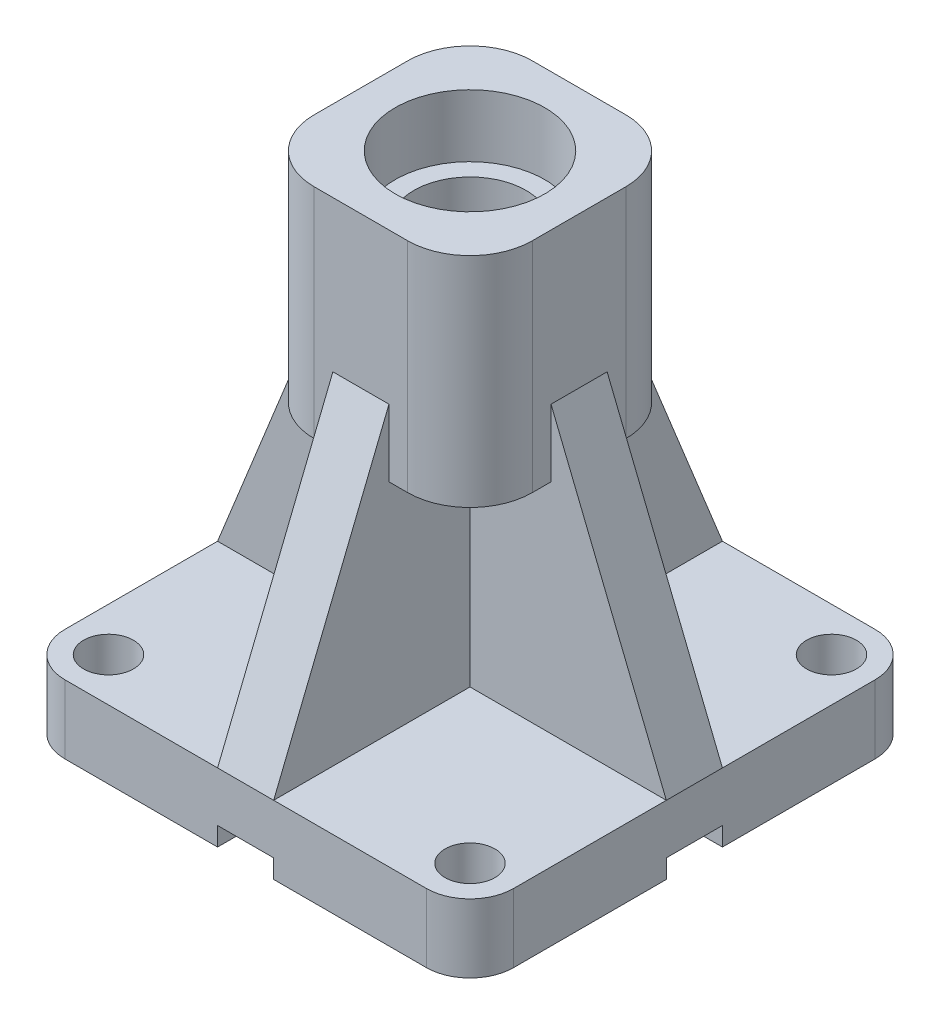
from build123d import *

# Parameters (mm, degrees)
EXTRUDE_1_DEPTH              = 11
EXTRUDE_2_DEPTH              = 4.5
EXTRUDE_3_DEPTH              = 4.5
EXTRUDE_4_DEPTH              = 35
HOLE_WIZARD_M4_1_D           = 18
HOLE_WIZARD_M4_1_DEPTH       = 20
HOLE_WIZARD_M4_1_CBORE_D     = 24
HOLE_WIZARD_M4_1_CBORE_DEPTH = 10
HOLE_WIZARD_M4_1_TIP         = 5.407745571
SKETCH_14_R                  = 4
CUT_EXTRUDE_1_DEPTH          = 15
CUT_EXTRUDE_2_DEPTH          = 96.671312315
CUT_EXTRUDE_2_DEPTH_BACK     = 96.671312315
SKETCH_15_W                  = 9
SKETCH_15_H                  = 3
CUT_EXTRUDE_3_DEPTH          = 96.671312315
CUT_EXTRUDE_3_DEPTH_BACK     = 96.671312315
SKETCH_16_W                  = 9
SKETCH_16_H                  = 3


with BuildPart() as part:
    # 스케치1 → 보스-돌출1 (new body)
    with BuildSketch(Plane(origin=(0, 0, 0), x_dir=(1, 0, 0), z_dir=(0, 1, 0))):
        with BuildLine():
            Line((-29, 36), (29, 36))
            ThreePointArc((29, 36), (33.949747468, 33.949747468), (36, 29))
            Line((36, 29), (36, -29))
            ThreePointArc((36, -29), (33.949747468, -33.949747468), (29, -36))
            Line((29, -36), (-29, -36))
            ThreePointArc((-29, -36), (-33.949747468, -33.949747468), (-36, -29))
            Line((-36, -29), (-36, 29))
            ThreePointArc((-36, 29), (-33.949747468, 33.949747468), (-29, 36))
        make_face()
    extrude(amount=EXTRUDE_1_DEPTH)

    # 스케치2 → 보스-돌출2 (add, symmetric)
    with BuildSketch(Plane.XY):
        Polygon((-36, 11), (-13.651164073, 66.315309992), (13.651164073, 66.315309992), (36, 11), align=None)
    extrude(amount=EXTRUDE_2_DEPTH, both=True)

    # 스케치3 → 보스-돌출3 (add, symmetric)
    with BuildSketch(Plane(origin=(0, 0, 0), x_dir=(0, 0, -1), z_dir=(1, 0, 0))):
        Polygon((-36, 11), (-13.651164073, 66.315309992), (13.651164073, 66.315309992), (36, 11), align=None)
    extrude(amount=EXTRUDE_3_DEPTH, both=True)

    # 스케치4 → 보스-돌출4 (add)
    with BuildSketch(Plane(origin=(0, 81, 0), x_dir=(1, 0, 0), z_dir=(0, 1, 0))):
        with BuildLine():
            Line((-7.5, 17.5), (7.5, 17.5))
            ThreePointArc((7.5, 17.5), (14.571067812, 14.571067812), (17.5, 7.5))
            Line((17.5, 7.5), (17.5, -7.5))
            ThreePointArc((17.5, -7.5), (14.571067812, -14.571067812), (7.5, -17.5))
            Line((7.5, -17.5), (-7.5, -17.5))
            ThreePointArc((-7.5, -17.5), (-14.571067812, -14.571067812), (-17.5, -7.5))
            Line((-17.5, -7.5), (-17.5, 7.5))
            ThreePointArc((-17.5, 7.5), (-14.571067812, 14.571067812), (-7.5, 17.5))
        make_face()
    extrude(amount=-EXTRUDE_4_DEPTH)

    # M4 소켓 머리 캡 나사용 카운터보어1
    with Locations(Plane(origin=(0, 81, 0), x_dir=(1, 0, 0), z_dir=(0, 1, 0))):
        with Locations((0, 0)):
            CounterBoreHole(HOLE_WIZARD_M4_1_D / 2, HOLE_WIZARD_M4_1_CBORE_D / 2, HOLE_WIZARD_M4_1_CBORE_DEPTH, depth=HOLE_WIZARD_M4_1_DEPTH)
            with Locations((0, 0, -(HOLE_WIZARD_M4_1_DEPTH + HOLE_WIZARD_M4_1_TIP / 2))):  # 118° drill point
                Cone(0, HOLE_WIZARD_M4_1_D / 2, HOLE_WIZARD_M4_1_TIP, mode=Mode.SUBTRACT)

    # 스케치14 → 컷-돌출1 (cut)
    with BuildSketch(Plane.XZ):
        with Locations(Location((-29, 29, 0), (0, 0, 270))):
            Circle(SKETCH_14_R)
        with Locations(Location((29, 29, 0), (0, 0, 270))):
            Circle(SKETCH_14_R)
        with Locations(Location((-29, -29, 0), (0, 0, 270))):
            Circle(SKETCH_14_R)
        with Locations(Location((29, -29, 0), (0, 0, 270))):
            Circle(SKETCH_14_R)
    extrude(amount=-CUT_EXTRUDE_1_DEPTH, mode=Mode.SUBTRACT)

    # 스케치15 → 컷-돌출2 (cut, two sides: drawn at the far end of the back side and taken through both)
    with BuildSketch(Plane(origin=(0, 0, 0), x_dir=(0, 0, -1), z_dir=(1, 0, 0)).offset(-CUT_EXTRUDE_2_DEPTH_BACK)):
        with Locations((0, 1.5)):
            Rectangle(SKETCH_15_W, SKETCH_15_H)
    extrude(amount=CUT_EXTRUDE_2_DEPTH + CUT_EXTRUDE_2_DEPTH_BACK, mode=Mode.SUBTRACT)

    # 스케치16 → 컷-돌출3 (cut, two sides: drawn at the far end of the back side and taken through both)
    with BuildSketch(Plane.XY.offset(-CUT_EXTRUDE_3_DEPTH_BACK)):
        with Locations((0, 1.5)):
            Rectangle(SKETCH_16_W, SKETCH_16_H)
    extrude(amount=CUT_EXTRUDE_3_DEPTH + CUT_EXTRUDE_3_DEPTH_BACK, mode=Mode.SUBTRACT)


solid = part.part
